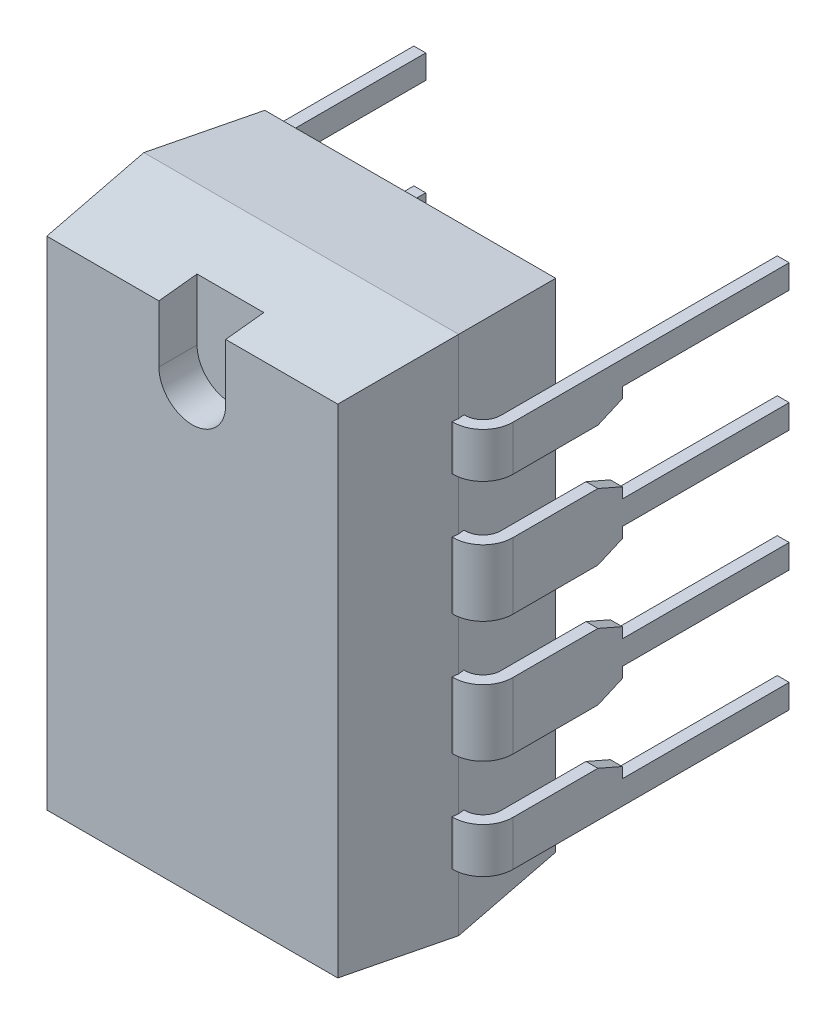
from build123d import *

# Parameters (mm, degrees)
BASIC_SHAPE_DEPTH              = 5.46
SIDE_PROFILE1_DEPTH            = 9.155243712
SIDE_PROFILE1_DEPTH_BACK       = 9.155243712
SIDE_PROFILE2_DEPTH            = 9.155243712
SIDE_PROFILE2_DEPTH_BACK       = 9.155243712
LOCATION_MARK_DEPTH            = 0.8
SKETCH6_W                      = 0.25
SKETCH6_H                      = 1.39
PIN_RELIEF_DEPTH               = 11.390535357
REMAINING_PINS_COUNT           = 4
REMAINING_PINS_PITCH           = 2.54
REMAINING_PINS_COPY_1_SKETCH_W = 0.25
REMAINING_PINS_COPY_1_SKETCH_H = 1.39
REMAINING_PINS_COPY_2_SKETCH_W = 0.25
REMAINING_PINS_COPY_2_SKETCH_H = 1.39
REMAINING_PINS_COPY_3_SKETCH_W = 0.25
REMAINING_PINS_COPY_3_SKETCH_H = 1.39
REMAINING_PINS_COPY_4_DEPTH    = 11.390535357
REMAINING_PINS_COPY_5_DEPTH    = 11.390535357
REMAINING_PINS_COPY_6_DEPTH    = 11.390535357
PIN_SHAPE1_DEPTH               = 0.445
PIN_SHAPE2_DEPTH               = 0.445


with BuildPart() as part:
    # Sketch1 → Basic Shape (new, symmetric)
    with BuildSketch(Plane(origin=(0, 0, 0), x_dir=(1, 0, 0), z_dir=(0, 1, 0))):
        Polygon((-3.05, -0.51), (-3.3, -2.795), (-3.05, -5.08), (3.05, -5.08), (3.3, -2.795), (3.05, -0.51), align=None)
    extrude(amount=BASIC_SHAPE_DEPTH, both=True)

    # Sketch2 → Side Profile1 (cut, two sides: drawn at the far end of the back side and taken through both)
    with BuildSketch(Plane(origin=(0, 0, 0), x_dir=(0, 0, -1), z_dir=(1, 0, 0)).offset(-SIDE_PROFILE1_DEPTH_BACK)):
        Polygon((-5.08, 5.46), (-5.08, 5.21), (-2.795, 5.46), align=None)
        Polygon((-5.08, -5.46), (-2.795, -5.46), (-5.08, -5.21), align=None)
    extrude(amount=SIDE_PROFILE1_DEPTH + SIDE_PROFILE1_DEPTH_BACK, mode=Mode.SUBTRACT)

    # Sketch3 → Side Profile2 (cut, two sides: drawn at the far end of the back side and taken through both)
    with BuildSketch(Plane(origin=(0, 0, 0), x_dir=(0, 0, -1), z_dir=(1, 0, 0)).offset(-SIDE_PROFILE2_DEPTH_BACK)):
        Polygon((-2.795, 5.46), (-0.51, 5.46), (-0.51, 5.21), align=None)
        Polygon((-2.795, -5.46), (-0.51, -5.46), (-0.51, -5.21), align=None)
    extrude(amount=SIDE_PROFILE2_DEPTH + SIDE_PROFILE2_DEPTH_BACK, mode=Mode.SUBTRACT)

    # Sketch4 → Location Mark (cut)
    with BuildSketch(Plane(origin=(0, 0, 5.08), x_dir=(-1, 0, 0), z_dir=(0, 0, -1))):
        with BuildLine():
            Line((0.7, 6.21), (-0.7, 6.21))
            Line((-0.7, 6.21), (-0.7, 5.21))
            Line((-0.7, 5.21), (-0.7, 4.01))
            ThreePointArc((-0.7, 4.01), (0, 3.31), (0.7, 4.01))
            Line((0.7, 4.01), (0.7, 5.21))
            Line((0.7, 5.21), (0.7, 6.21))
        make_face()
    extrude(amount=LOCATION_MARK_DEPTH, mode=Mode.SUBTRACT)

    # First Pin: sweep along a path in Sketch5
    with BuildLine(Plane(origin=(0, -3.94, 0), x_dir=(1, 0, 0), z_dir=(0, 1, 0))) as first_pin_path:
        Line((0, -2.795), (3.31, -2.795))
        ThreePointArc((3.31, -2.795), (3.663553391, -2.648553391), (3.81, -2.295))
        Line((3.81, -2.295), (3.81, 3.5))
    # Sketch6 → First Pin (sweep)
    with BuildSketch(Plane(origin=(0, 0, 0), x_dir=(0, 0, -1), z_dir=(1, 0, 0))):
        with Locations((-2.795, -3.94)):
            Rectangle(SKETCH6_W, SKETCH6_H)
    first_pin = sweep(path=first_pin_path.line)

    # Sketch7 → Pin Relief (cut, through all)
    with BuildSketch(Plane(origin=(3.935, 0, 0), x_dir=(0, 0, -1), z_dir=(1, 0, 0))):
        Polygon((0, -4.19), (3.5, -4.19), (3.5, -4.635), (-0.51, -4.635), (0, -4.4125), align=None)
        Polygon((0, -3.69), (3.5, -3.69), (3.5, -3.245), (-0.51, -3.245), (0, -3.4675), align=None)
    pin_relief = extrude(amount=-PIN_RELIEF_DEPTH, mode=Mode.SUBTRACT)

    # Opp Pin: First Pin, Pin Relief across plane
    add(first_pin.mirror(Plane(origin=(0, 0, 0), x_dir=(0, 0, 1), z_dir=(1, 0, 0))))
    add(pin_relief.mirror(Plane(origin=(0, 0, 0), x_dir=(0, 0, 1), z_dir=(1, 0, 0))), mode=Mode.SUBTRACT)

    # Remaining Pins: First Pin, Pin Relief ×4
    with Locations(*[(0, i * REMAINING_PINS_PITCH, 0) for i in range(1, REMAINING_PINS_COUNT)]):
        add(first_pin)
        add(pin_relief, mode=Mode.SUBTRACT)

    # Remaining Pins copy 1: sweep along a path in Remaining Pins copy 1 path
    with BuildLine(Plane(origin=(0, -1.4, 0), x_dir=(-1, 0, 0), z_dir=(0, 1, 0))) as remaining_pins_copy_1_path:
        Line((0, 2.795), (3.31, 2.795))
        ThreePointArc((3.31, 2.795), (3.663553391, 2.648553391), (3.81, 2.295))
        Line((3.81, 2.295), (3.81, -3.5))
    # Remaining Pins copy 1 sketch → Remaining Pins copy 1 (sweep)
    with BuildSketch(Plane(origin=(0, 2.54, 0), x_dir=(0, 0, -1), z_dir=(-1, 0, 0))):
        with Locations((-2.795, 3.94)):
            Rectangle(REMAINING_PINS_COPY_1_SKETCH_W, REMAINING_PINS_COPY_1_SKETCH_H)
    sweep(path=remaining_pins_copy_1_path.line)

    # Remaining Pins copy 2: sweep along a path in Remaining Pins copy 2 path
    with BuildLine(Plane(origin=(0, 1.14, 0), x_dir=(-1, 0, 0), z_dir=(0, 1, 0))) as remaining_pins_copy_2_path:
        Line((0, 2.795), (3.31, 2.795))
        ThreePointArc((3.31, 2.795), (3.663553391, 2.648553391), (3.81, 2.295))
        Line((3.81, 2.295), (3.81, -3.5))
    # Remaining Pins copy 2 sketch → Remaining Pins copy 2 (sweep)
    with BuildSketch(Plane(origin=(0, 5.08, 0), x_dir=(0, 0, -1), z_dir=(-1, 0, 0))):
        with Locations((-2.795, 3.94)):
            Rectangle(REMAINING_PINS_COPY_2_SKETCH_W, REMAINING_PINS_COPY_2_SKETCH_H)
    sweep(path=remaining_pins_copy_2_path.line)

    # Remaining Pins copy 3: sweep along a path in Remaining Pins copy 3 path
    with BuildLine(Plane(origin=(0, 3.68, 0), x_dir=(-1, 0, 0), z_dir=(0, 1, 0))) as remaining_pins_copy_3_path:
        Line((0, 2.795), (3.31, 2.795))
        ThreePointArc((3.31, 2.795), (3.663553391, 2.648553391), (3.81, 2.295))
        Line((3.81, 2.295), (3.81, -3.5))
    # Remaining Pins copy 3 sketch → Remaining Pins copy 3 (sweep)
    with BuildSketch(Plane(origin=(0, 7.62, 0), x_dir=(0, 0, -1), z_dir=(-1, 0, 0))):
        with Locations((-2.795, 3.94)):
            Rectangle(REMAINING_PINS_COPY_3_SKETCH_W, REMAINING_PINS_COPY_3_SKETCH_H)
    sweep(path=remaining_pins_copy_3_path.line)

    # Remaining Pins copy 4 sketch → Remaining Pins copy 4 (cut, through all)
    with BuildSketch(Plane(origin=(-3.935, 2.54, 0), x_dir=(0, 0, -1), z_dir=(-1, 0, 0))):
        Polygon((0, 4.19), (3.5, 4.19), (3.5, 4.635), (-0.51, 4.635), (0, 4.4125), align=None)
        Polygon((0, 3.69), (3.5, 3.69), (3.5, 3.245), (-0.51, 3.245), (0, 3.4675), align=None)
    extrude(amount=-REMAINING_PINS_COPY_4_DEPTH, mode=Mode.SUBTRACT)

    # Remaining Pins copy 5 sketch → Remaining Pins copy 5 (cut, through all)
    with BuildSketch(Plane(origin=(-3.935, 5.08, 0), x_dir=(0, 0, -1), z_dir=(-1, 0, 0))):
        Polygon((0, 4.19), (3.5, 4.19), (3.5, 4.635), (-0.51, 4.635), (0, 4.4125), align=None)
        Polygon((0, 3.69), (3.5, 3.69), (3.5, 3.245), (-0.51, 3.245), (0, 3.4675), align=None)
    extrude(amount=-REMAINING_PINS_COPY_5_DEPTH, mode=Mode.SUBTRACT)

    # Remaining Pins copy 6 sketch → Remaining Pins copy 6 (cut, through all)
    with BuildSketch(Plane(origin=(-3.935, 7.62, 0), x_dir=(0, 0, -1), z_dir=(-1, 0, 0))):
        Polygon((0, 4.19), (3.5, 4.19), (3.5, 4.635), (-0.51, 4.635), (0, 4.4125), align=None)
        Polygon((0, 3.69), (3.5, 3.69), (3.5, 3.245), (-0.51, 3.245), (0, 3.4675), align=None)
    extrude(amount=-REMAINING_PINS_COPY_6_DEPTH, mode=Mode.SUBTRACT)

    # Sketch9 → Pin Shape1 (cut)
    with BuildSketch(Plane.XZ.offset(4.635)):
        with BuildLine():
            Line((3.935, 0), (3.685, 0))
            Line((3.685, 0), (3.685, 2.295))
            ThreePointArc((3.685, 2.295), (3.575165043, 2.560165043), (3.31, 2.67))
            Line((3.31, 2.67), (3.286323851, 2.67))
            Line((3.286323851, 2.67), (3.3, 2.795))
            Line((3.3, 2.795), (3.286323851, 2.92))
            Line((3.286323851, 2.92), (3.31, 2.92))
            ThreePointArc((3.31, 2.92), (3.751941738, 2.736941738), (3.935, 2.295))
            Line((3.935, 2.295), (3.935, 0))
        make_face()
        with BuildLine():
            Line((-3.685, 0), (-3.935, 0))
            Line((-3.935, 0), (-3.935, 2.295))
            ThreePointArc((-3.935, 2.295), (-3.751941738, 2.736941738), (-3.31, 2.92))
            Line((-3.31, 2.92), (-3.286323851, 2.92))
            Line((-3.286323851, 2.92), (-3.3, 2.795))
            Line((-3.3, 2.795), (-3.286323851, 2.67))
            Line((-3.286323851, 2.67), (-3.31, 2.67))
            ThreePointArc((-3.31, 2.67), (-3.575165043, 2.560165043), (-3.685, 2.295))
            Line((-3.685, 2.295), (-3.685, 0))
        make_face()
    extrude(amount=-PIN_SHAPE1_DEPTH, mode=Mode.SUBTRACT)

    # Sketch10 → Pin Shape2 (cut)
    with BuildSketch(Plane(origin=(0, 4.375, 0), x_dir=(-1, 0, 0), z_dir=(0, 1, 0))):
        with BuildLine():
            Line((3.685, 0), (3.935, 0))
            Line((3.935, 0), (3.935, 2.295))
            ThreePointArc((3.935, 2.295), (3.751941738, 2.736941738), (3.31, 2.92))
            Line((3.31, 2.92), (3.286323851, 2.92))
            Line((3.286323851, 2.92), (3.3, 2.795))
            Line((3.3, 2.795), (3.286323851, 2.67))
            Line((3.286323851, 2.67), (3.31, 2.67))
            ThreePointArc((3.31, 2.67), (3.575165043, 2.560165043), (3.685, 2.295))
            Line((3.685, 2.295), (3.685, 0))
        make_face()
        with BuildLine():
            Line((-3.685, 0), (-3.935, 0))
            Line((-3.935, 0), (-3.935, 2.295))
            ThreePointArc((-3.935, 2.295), (-3.751941738, 2.736941738), (-3.31, 2.92))
            Line((-3.31, 2.92), (-3.286323851, 2.92))
            Line((-3.286323851, 2.92), (-3.3, 2.795))
            Line((-3.3, 2.795), (-3.286323851, 2.67))
            Line((-3.286323851, 2.67), (-3.31, 2.67))
            ThreePointArc((-3.31, 2.67), (-3.575165043, 2.560165043), (-3.685, 2.295))
            Line((-3.685, 2.295), (-3.685, 0))
        make_face()
    extrude(amount=-PIN_SHAPE2_DEPTH, mode=Mode.SUBTRACT)


solid = part.part
